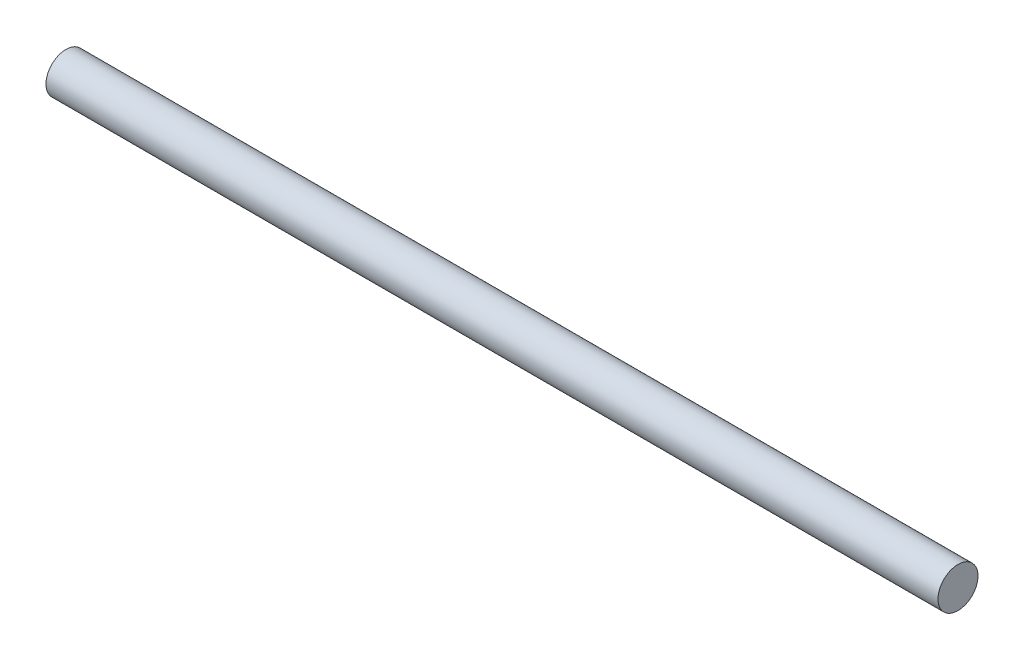
from build123d import *

# Parameters (mm, degrees)
SKETCH1_R           = 1.75
BOSS_EXTRUDE1_DEPTH = 78


with BuildPart() as part:
    # Sketch1 → Boss-Extrude1 (new body)
    with BuildSketch(Plane(origin=(0, 0, 0), x_dir=(0, 0, -1), z_dir=(1, 0, 0))):
        Circle(SKETCH1_R)
    extrude(amount=BOSS_EXTRUDE1_DEPTH)


solid = part.part
